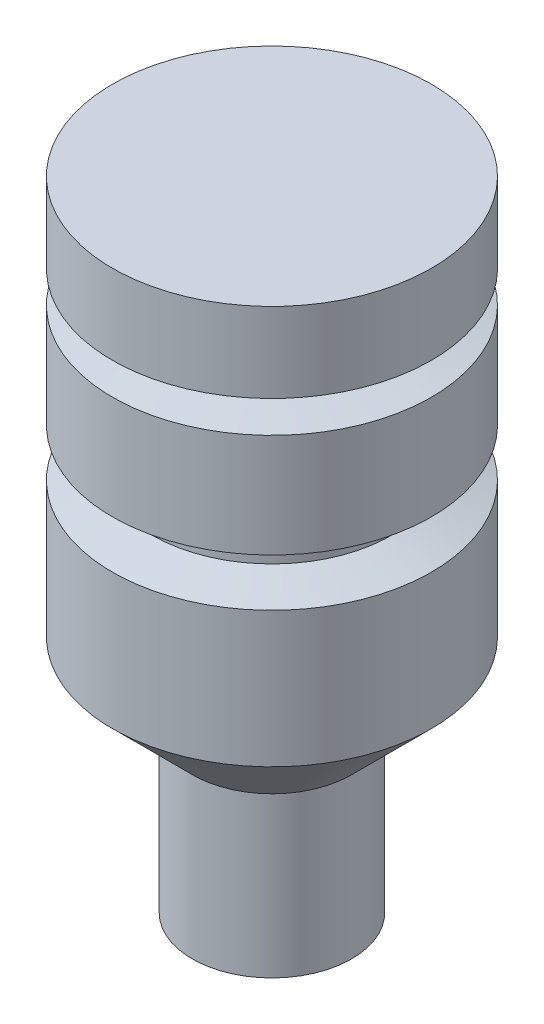
from build123d import *

# Parameters (mm, degrees)
M3_GEWINDEBOHRUNG1_D     = 2.5
M3_GEWINDEBOHRUNG1_DEPTH = 20
M3_GEWINDEBOHRUNG1_TIP   = 0.751075774


with BuildPart() as part:
    # Esboço1 → Revolução1 (revolve)
    with BuildSketch(Plane.XY, mode=Mode.PRIVATE) as revolu_o1_sk:
        Polygon((0, 0), (0, 40), (10, 40), (10, 35), (7.5, 34.5), (7.5, 33.5), (10, 33), (10, 26.5), (7.5, 25.75), (7.5, 24.25), (10, 23.5), (10, 15), (5, 10), (5, 0), align=None)
    revolve(revolu_o1_sk.sketch.rotate(Axis((0, 0, 0), (0, 1, 0)), 90), axis=Axis((0, 0, 0), (0, 1, 0)))

    # M3 Gewindebohrung1
    with Locations(Plane(origin=(0, 0, 0), x_dir=(0, 0, -1), z_dir=(0, -1, 0))):
        with Locations((0, 0)):
            Hole(M3_GEWINDEBOHRUNG1_D / 2, depth=M3_GEWINDEBOHRUNG1_DEPTH)
            with Locations((0, 0, -(M3_GEWINDEBOHRUNG1_DEPTH + M3_GEWINDEBOHRUNG1_TIP / 2))):  # 118° drill point
                Cone(0, M3_GEWINDEBOHRUNG1_D / 2, M3_GEWINDEBOHRUNG1_TIP, mode=Mode.SUBTRACT)


solid = part.part
